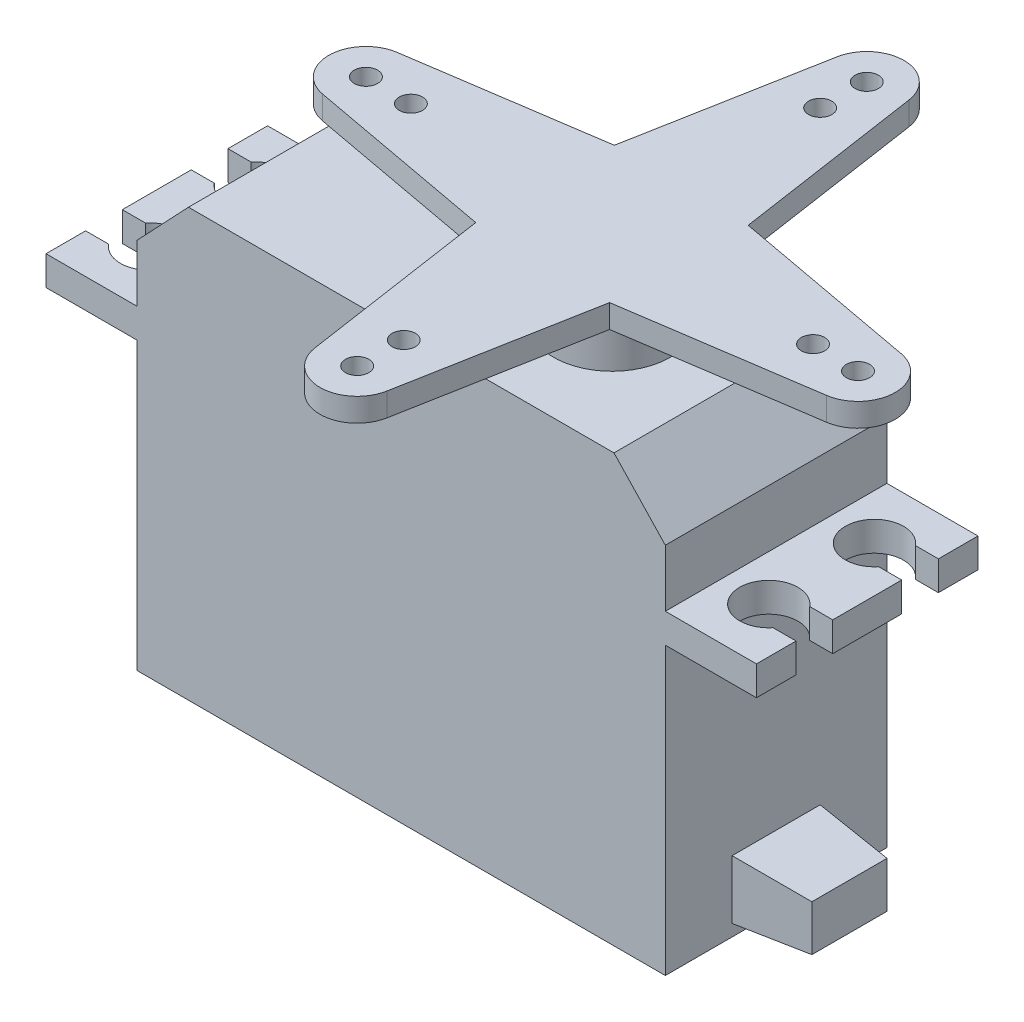
from build123d import *

# Parameters (mm, degrees)
BOSS_EXTRUDE1_DEPTH   = 7.55
CUT_EXTRUDE1_REACH    = 35.247
SKETCH3_R             = 3.96875
BOSS_EXTRUDE2_DEPTH   = 11.90625
SKETCH4_R             = 0.79375
BOSS_EXTRUDE3_DEPTH   = 1.5875
SKETCH5_W             = 6
SKETCH5_H             = 4
BOSS_EXTRUDE4_DEPTH   = 5
BOSS_EXTRUDE4_TAPER   = 5
BODY_MOVE_COPY1_ANGLE = 1


with BuildPart() as part:
    # Sketch1 → Boss-Extrude1 (new, symmetric)
    with BuildSketch(Plane.XY):
        Polygon((-24.209375, 2), (-24.209375, 0), (-18, 0), (-18, -19.5), (18, -19.5), (18, 0), (24.209375, 0), (24.209375, 2), (18, 2), (18, 5.9), (14.5, 9.6), (-14.5, 9.6), (-18, 5.9), (-18, 2), align=None)
    extrude(amount=BOSS_EXTRUDE1_DEPTH, both=True)

    # Sketch2 → Cut-Extrude1 (cut, up to next)
    with BuildSketch(Plane(origin=(0, 2, 0), x_dir=(1, 0, 0), z_dir=(0, 1, 0)), mode=Mode.PRIVATE) as cut_extrude1_sk1:
        with BuildLine():
            Line((-24.209375, -2.35), (-22.641182708, -2.35))
            ThreePointArc((-22.641182708, -2.35), (-19.115625, -3.6), (-22.641182708, -4.85))
            Line((-22.641182708, -4.85), (-24.209375, -4.85))
            Line((-24.209375, -4.85), (-24.209375, -2.35))
        make_face()
    cut_extrude1_tool1 = extrude(cut_extrude1_sk1.sketch, amount=-CUT_EXTRUDE1_REACH, mode=Mode.PRIVATE) & part.part
    # Sketch2 → Cut-Extrude1 (cut, up to next)
    with BuildSketch(Plane(origin=(0, 2, 0), x_dir=(1, 0, 0), z_dir=(0, 1, 0)), mode=Mode.PRIVATE) as cut_extrude1_sk2:
        with BuildLine():
            Line((24.209375, -2.35), (24.209375, -4.85))
            Line((24.209375, -4.85), (22.641182708, -4.85))
            ThreePointArc((22.641182708, -4.85), (19.115625, -3.6), (22.641182708, -2.35))
            Line((22.641182708, -2.35), (24.209375, -2.35))
        make_face()
    cut_extrude1_tool2 = extrude(cut_extrude1_sk2.sketch, amount=-CUT_EXTRUDE1_REACH, mode=Mode.PRIVATE) & part.part
    # Sketch2 → Cut-Extrude1 (cut, up to next)
    with BuildSketch(Plane(origin=(0, 2, 0), x_dir=(1, 0, 0), z_dir=(0, 1, 0)), mode=Mode.PRIVATE) as cut_extrude1_sk3:
        with BuildLine():
            Line((24.209375, 2.35), (22.641182708, 2.35))
            ThreePointArc((22.641182708, 2.35), (19.115625, 3.6), (22.641182708, 4.85))
            Line((22.641182708, 4.85), (24.209375, 4.85))
            Line((24.209375, 4.85), (24.209375, 2.35))
        make_face()
    cut_extrude1_tool3 = extrude(cut_extrude1_sk3.sketch, amount=-CUT_EXTRUDE1_REACH, mode=Mode.PRIVATE) & part.part
    # Sketch2 → Cut-Extrude1 (cut, up to next)
    with BuildSketch(Plane(origin=(0, 2, 0), x_dir=(1, 0, 0), z_dir=(0, 1, 0)), mode=Mode.PRIVATE) as cut_extrude1_sk4:
        with BuildLine():
            Line((-24.209375, 2.35), (-24.209375, 4.85))
            Line((-24.209375, 4.85), (-22.641182708, 4.85))
            ThreePointArc((-22.641182708, 4.85), (-19.115625, 3.6), (-22.641182708, 2.35))
            Line((-22.641182708, 2.35), (-24.209375, 2.35))
        make_face()
    cut_extrude1_tool4 = extrude(cut_extrude1_sk4.sketch, amount=-CUT_EXTRUDE1_REACH, mode=Mode.PRIVATE) & part.part
    add(cut_extrude1_tool1.solids().sort_by_distance((-21.603022, 2, 3.6))[0], mode=Mode.SUBTRACT)
    add(cut_extrude1_tool2.solids().sort_by_distance((21.603022, 2, 3.6))[0], mode=Mode.SUBTRACT)
    add(cut_extrude1_tool3.solids().sort_by_distance((21.603022, 2, -3.6))[0], mode=Mode.SUBTRACT)
    add(cut_extrude1_tool4.solids().sort_by_distance((-21.603022, 2, -3.6))[0], mode=Mode.SUBTRACT)

    # Sketch3 → Boss-Extrude2 (add)
    with BuildSketch(Plane(origin=(0, 2, 0), x_dir=(1, 0, 0), z_dir=(0, 1, 0))):
        with Locations(Location((6.8125, 0, 0), (0, 0, 90))):
            Circle(SKETCH3_R)
    extrude(amount=BOSS_EXTRUDE2_DEPTH)

    # Sketch5 → Boss-Extrude4 (add)
    with BuildSketch(Plane(origin=(18, 0, 0), x_dir=(0, 0, -1), z_dir=(1, 0, 0))):
        with Locations((0, -16.7)):
            Rectangle(SKETCH5_W, SKETCH5_H)
    extrude(amount=BOSS_EXTRUDE4_DEPTH, taper=BOSS_EXTRUDE4_TAPER)


with BuildPart() as body_2:
    # Sketch4 → Boss-Extrude3 (new body)
    with BuildSketch(Plane(origin=(0, 13.90625, 0), x_dir=(1, 0, 0), z_dir=(0, 1, 0))):
        with BuildLine():
            Line((2.169231166, 4.643268834), (-10.674676171, 2.5))
            ThreePointArc((-10.674676171, 2.5), (-12.792068199, 0), (-10.674676171, -2.5))
            Line((-10.674676171, -2.5), (2.169231166, -4.643268834))
            Line((2.169231166, -4.643268834), (4.3125, -17.487176171))
            ThreePointArc((4.3125, -17.487176171), (6.8125, -19.604568199), (9.3125, -17.487176171))
            Line((9.3125, -17.487176171), (11.455768834, -4.643268834))
            Line((11.455768834, -4.643268834), (24.299676171, -2.5))
            ThreePointArc((24.299676171, -2.5), (26.417068199, 0), (24.299676171, 2.5))
            Line((24.299676171, 2.5), (11.455768834, 4.643268834))
            Line((11.455768834, 4.643268834), (9.3125, 17.487176171))
            ThreePointArc((9.3125, 17.487176171), (6.8125, 19.604568199), (4.3125, 17.487176171))
            Line((4.3125, 17.487176171), (2.169231166, 4.643268834))
        make_face()
        with Locations(Location((-10.2575, 0, 0), (0, 0, 180))):
            Circle(SKETCH4_R, mode=Mode.SUBTRACT)
        with Locations(Location((6.8125, 17.07, 0), (0, 0, 180))):
            Circle(SKETCH4_R, mode=Mode.SUBTRACT)
        with Locations(Location((23.8825, 0, 0), (0, 0, 180))):
            Circle(SKETCH4_R, mode=Mode.SUBTRACT)
        with Locations(Location((6.8125, -17.07, 0), (0, 0, 180))):
            Circle(SKETCH4_R, mode=Mode.SUBTRACT)
        with Locations(Location((-7.1375, 0, 0), (0, 0, 180))):
            Circle(SKETCH4_R, mode=Mode.SUBTRACT)
        with Locations(Location((6.8125, 13.95, 0), (0, 0, 180))):
            Circle(SKETCH4_R, mode=Mode.SUBTRACT)
        with Locations(Location((20.7625, 0, 0), (0, 0, 180))):
            Circle(SKETCH4_R, mode=Mode.SUBTRACT)
        with Locations(Location((6.8125, -13.95, 0), (0, 0, 180))):
            Circle(SKETCH4_R, mode=Mode.SUBTRACT)
    extrude(amount=BOSS_EXTRUDE3_DEPTH)


with BuildPart() as body_2_1:
    # Body-Move/Copy1: moved
    add(body_2.part.moved(Location((0, 0, 0))).rotate(Axis((6.8125, 0, 0), (0, -1, 0)), BODY_MOVE_COPY1_ANGLE))


solid = Compound([part.part, body_2_1.part])
